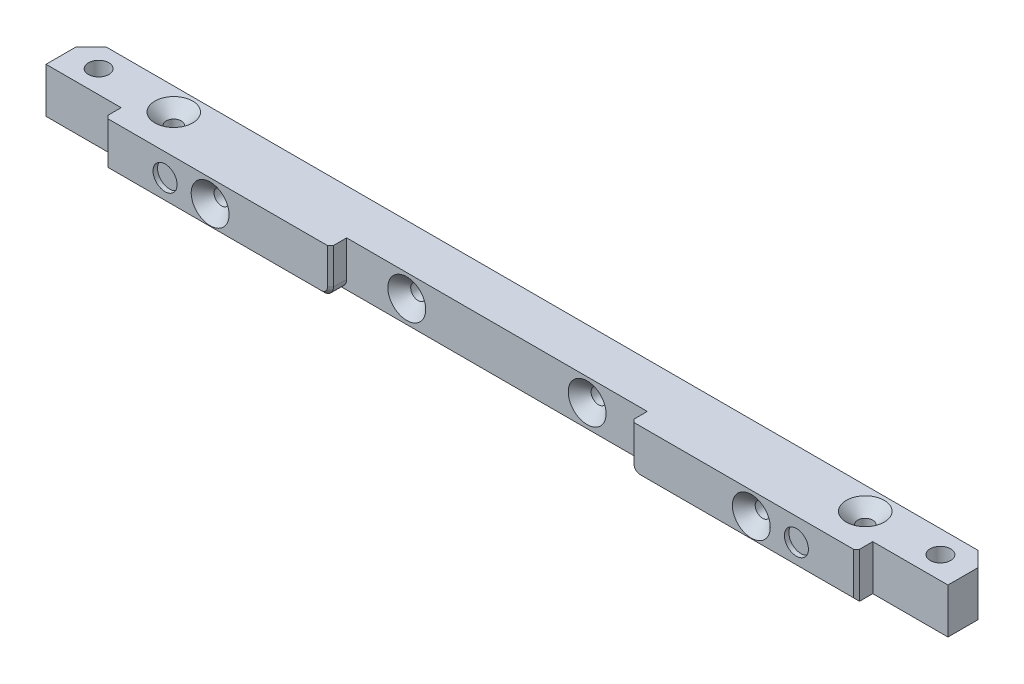
from build123d import *

# Parameters (mm, degrees)
SKETCH_1_W                   = 300
SKETCH_1_H                   = 15
EXTRUDE_349_DEPTH            = 15
HOLE_WIZARD_M6_D             = 5
HOLE_WIZARD_M6_CSINK_D       = 12.6
HOLE_WIZARD_M6_CSINK_ANGLE   = 90
HOLE_WIZARD_M8_D             = 6.8
SKETCH_8_W                   = 250
SKETCH_8_H                   = 15
EXTRUDE_2463_DEPTH           = 5.4
SKETCH_9_R                   = 4
CUT_EXTRUDE_2783_DEPTH       = 1.5
SKETCH_10_W                  = 100
SKETCH_10_H                  = 15
CUT_EXTRUDE_3071_DEPTH       = 5.4
HOLE_WIZARD_1_M6_D           = 5
HOLE_WIZARD_1_M6_CSINK_D     = 12.6
HOLE_WIZARD_1_M6_CSINK_ANGLE = 90
HOLE_WIZARD_2_M6_D           = 5
HOLE_WIZARD_2_M6_CSINK_D     = 12.6
HOLE_WIZARD_2_M6_CSINK_ANGLE = 90
FILLET_1_R                   = 3
CHAMFER_1_SIZE               = 5
CHAMFER_2_SIZE               = 1


with BuildPart() as part:
    # Эскиз1 → Extrude 349 (new body)
    with BuildSketch(Plane(origin=(0, 0, 0), x_dir=(1, 0, 0), z_dir=(0, 1, 0))):
        Rectangle(SKETCH_1_W, SKETCH_1_H)
    extrude(amount=EXTRUDE_349_DEPTH)

    # Крепление шарнира M6 (through all)
    with Locations(Plane(origin=(0, 15, 0), x_dir=(1, 0, 0), z_dir=(0, 1, 0))):
        with Locations((-115, 0), (115, 0)):
            CounterSinkHole(HOLE_WIZARD_M6_D / 2, HOLE_WIZARD_M6_CSINK_D / 2, counter_sink_angle=HOLE_WIZARD_M6_CSINK_ANGLE)

    # Шпилька-M8 (through all)
    with Locations(Plane(origin=(0, 15, 0), x_dir=(1, 0, 0), z_dir=(0, 1, 0))):
        with Locations((-140, 0), (140, 0)):
            Hole(HOLE_WIZARD_M8_D / 2)

    # Эскиз8 → Extrude 2463 (add)
    with BuildSketch(Plane.XY.offset(7.5)):
        with Locations((0, 7.5)):
            Rectangle(SKETCH_8_W, SKETCH_8_H)
    extrude(amount=EXTRUDE_2463_DEPTH)

    # Эскиз9 → Cut-Extrude 2783 (cut)
    with BuildSketch(Plane.XY.offset(12.9)):
        with Locations((-105, 7.5)):
            Circle(SKETCH_9_R)
        with Locations((105, 7.5)):
            Circle(SKETCH_9_R)
    extrude(amount=-CUT_EXTRUDE_2783_DEPTH, mode=Mode.SUBTRACT)

    # Эскиз10 → Cut-Extrude 3071 (cut)
    with BuildSketch(Plane.XY.offset(12.9)):
        with Locations((0, 7.5)):
            Rectangle(SKETCH_10_W, SKETCH_10_H)
    extrude(amount=-CUT_EXTRUDE_3071_DEPTH, mode=Mode.SUBTRACT)

    # Прижим-1-M6 (through all)
    with Locations(Plane.XY.offset(12.9)):
        with Locations((-90, 7.5), (90, 7.5)):
            CounterSinkHole(HOLE_WIZARD_1_M6_D / 2, HOLE_WIZARD_1_M6_CSINK_D / 2, counter_sink_angle=HOLE_WIZARD_1_M6_CSINK_ANGLE)

    # Прижим-2-M6 (through all)
    with Locations(Plane.XY.offset(7.5)):
        with Locations((-30, 7.5), (30, 7.5)):
            CounterSinkHole(HOLE_WIZARD_2_M6_D / 2, HOLE_WIZARD_2_M6_CSINK_D / 2, counter_sink_angle=HOLE_WIZARD_2_M6_CSINK_ANGLE)

    # Скругление1
    fillet_1_edges = [part.edges().sort_by_distance(p)[0] for p in [
        (-50, 0, 10.2),
        (50, 0, 10.2),
    ]]
    fillet(fillet_1_edges, radius=FILLET_1_R)

    # Фаска1
    chamfer_1_edges = [part.edges().sort_by_distance(p)[0] for p in [
        (-150, 7.5, -7.5),
        (150, 7.5, -7.5),
    ]]
    chamfer(chamfer_1_edges, length=CHAMFER_1_SIZE)

    # Фаска2
    chamfer_2_edges = [part.edges().sort_by_distance(p)[0] for p in [
        (-50.878679656, 0.878679656, 12.9),
        (-125, 7.5, 12.9),
        (-89, 0, 12.9),
        (125, 7.5, 12.9),
        (-50, 9, 12.9),
        (50, 9, 12.9),
        (89, 0, 12.9),
        (50.878679656, 0.878679656, 12.9),
    ]]
    chamfer(chamfer_2_edges, length=CHAMFER_2_SIZE)


solid = part.part
